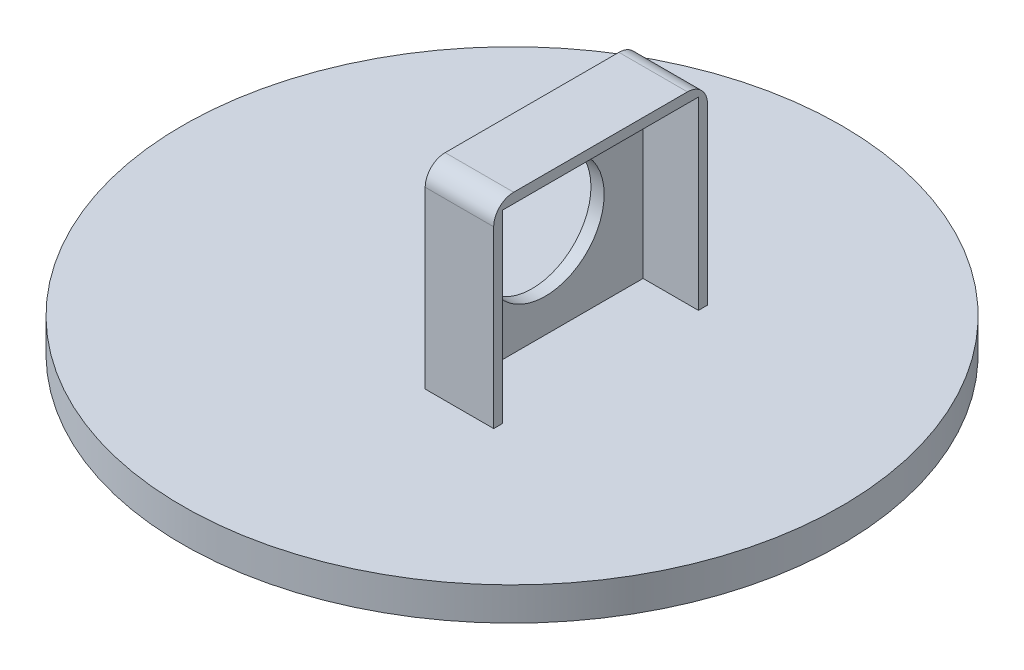
from build123d import *

# Parameters (mm, degrees)
SKETCH_1_R          = 165
EXTRUDE_1_DEPTH     = 16.6
SKETCH_2_R          = 30
CUT_EXTRUDE_1_DEPTH = 6.6
SKETCH_3_R          = 2.5
SKETCH_3_R_2        = 2
CUT_EXTRUDE_2_DEPTH = 234.559414283
SKETCH_4_W          = 107
SKETCH_4_H          = 97.5
EXTRUDE_2_DEPTH     = 34.3
SKETCH_5_W          = 98
SKETCH_5_H          = 92.5
CUT_EXTRUDE_3_DEPTH = 27.7
SKETCH_6_R          = 29.5
CUT_EXTRUDE_4_DEPTH = 6.6
FILLET_1_R          = 10


with BuildPart() as part:
    # 草图1 → 凸台-拉伸1 (new body)
    with BuildSketch(Plane(origin=(0, 0, 0), x_dir=(1, 0, 0), z_dir=(0, 1, 0))):
        with Locations(Location((0, 0, 0), (0, 0, 90))):
            Circle(SKETCH_1_R)
    extrude(amount=EXTRUDE_1_DEPTH)

    # 草图2 → 切除-拉伸1 (cut)
    with BuildSketch(Plane.XZ):
        with Locations(Location((0, 0, 0), (0, 0, 270))):
            Circle(SKETCH_2_R)
    extrude(amount=-CUT_EXTRUDE_1_DEPTH, mode=Mode.SUBTRACT)

    # 草图3 → 切除-拉伸2 (cut, through all)
    with BuildSketch(Plane.XZ.offset(-6.6)):
        with Locations(Location((0, 0, 0), (0, 0, 270))):
            Circle(SKETCH_3_R)
        with Locations(Location((0, 17.25, 0), (0, 0, 270))):
            Circle(SKETCH_3_R_2)
        with Locations(Location((0, -17.25, 0), (0, 0, 270))):
            Circle(SKETCH_3_R_2)
    extrude(amount=-CUT_EXTRUDE_2_DEPTH, mode=Mode.SUBTRACT)

    # 草图4 → 凸台-拉伸2 (add)
    with BuildSketch(Plane(origin=(10, 0, 0), x_dir=(0, 0, -1), z_dir=(1, 0, 0))):
        with Locations((0, 65.35)):
            Rectangle(SKETCH_4_W, SKETCH_4_H)
    extrude(amount=EXTRUDE_2_DEPTH)

    # 草图5 → 切除-拉伸3 (cut)
    with BuildSketch(Plane(origin=(44.3, 0, 0), x_dir=(0, 0, -1), z_dir=(1, 0, 0))):
        with Locations((0, 62.85)):
            Rectangle(SKETCH_5_W, SKETCH_5_H)
    extrude(amount=-CUT_EXTRUDE_3_DEPTH, mode=Mode.SUBTRACT)

    # 草图6 → 切除-拉伸4 (cut)
    with BuildSketch(Plane(origin=(16.6, 0, 0), x_dir=(0, 0, -1), z_dir=(1, 0, 0))):
        with Locations((0, 62.85)):
            Circle(SKETCH_6_R)
    extrude(amount=-CUT_EXTRUDE_4_DEPTH, mode=Mode.SUBTRACT)

    # 圆角1
    fillet_1_edges = [part.edges().sort_by_distance(p)[0] for p in [
        (27.15, 114.1, 53.5),
        (27.15, 114.1, -53.5),
    ]]
    fillet(fillet_1_edges, radius=FILLET_1_R)


solid = part.part
